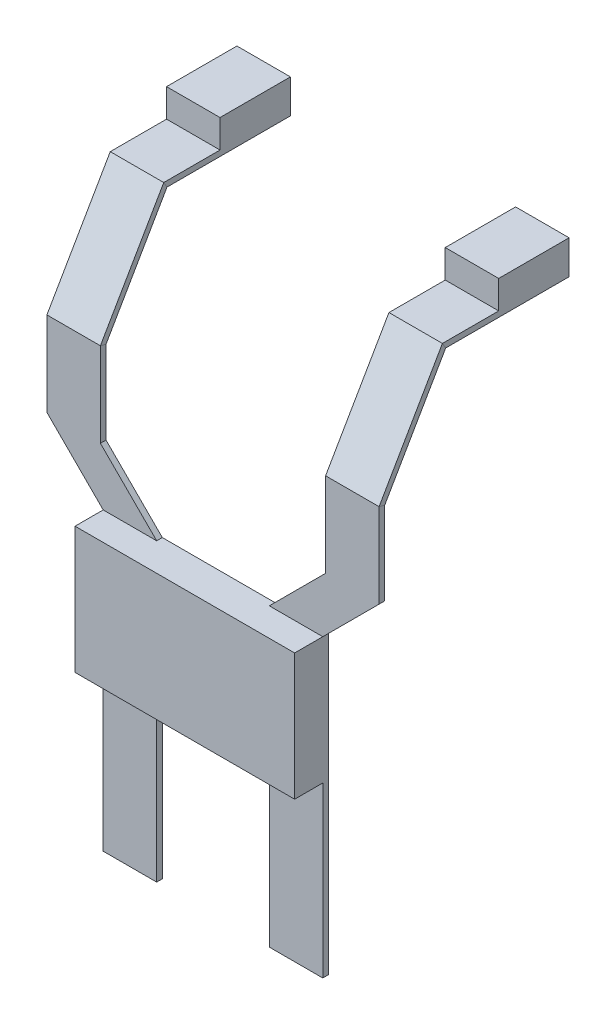
from build123d import *

# Parameters (mm, degrees)
EXTRUDE_1_DEPTH = 4
SKETCH_11_W     = 156
SKETCH_11_H     = 90
EXTRUDE_2_DEPTH = 20
SKETCH_12_W     = 38
SKETCH_12_H     = 4
SKETCH_14_W     = 38
SKETCH_14_H     = 50
EXTRUDE_3_DEPTH = 20


with BuildPart() as part:
    # 草图1 → 凸台-拉伸1 (new body)
    with BuildSketch(Plane.XY):
        Polygon((-40, 0), (40, 0), (40, -160), (78, -160), (78, 0), (78, 50), (118, 90), (80, 90), (40, 50), (-40, 50), (-80, 90), (-118, 90), (-78, 50), (-78, 0), (-78, -160), (-40, -160), align=None)
    extrude(amount=EXTRUDE_1_DEPTH)

    # 草图11 → 凸台-拉伸2 (add)
    with BuildSketch(Plane.XY.offset(4)):
        with Locations((0, 5)):
            Rectangle(SKETCH_11_W, SKETCH_11_H)
    extrude(amount=EXTRUDE_2_DEPTH)

    # 扫描1: sweep along a path in 草图13
    with BuildLine(Plane(origin=(78, 0, 0), x_dir=(0, 0, -1), z_dir=(1, 0, 0))) as sweep_1_path:
        Line((-4, 90), (-4, 150))
        Line((-4, 150), (41, 227.942286341))
        Line((41, 227.942286341), (131, 227.942286341))
    # 草图12 → 扫描1 (sweep)
    with BuildSketch(Plane(origin=(0, 90, 0), x_dir=(1, 0, 0), z_dir=(0, 1, 0))):
        with Locations((-99, -2)):
            Rectangle(SKETCH_12_W, SKETCH_12_H)
        with Locations((99, -2)):
            Rectangle(SKETCH_12_W, SKETCH_12_H)
    sweep(path=sweep_1_path.line, transition=Transition.RIGHT)

    # 草图14 → 凸台-拉伸3 (add)
    with BuildSketch(Plane(origin=(0, 227.942286341, 0), x_dir=(1, 0, 0), z_dir=(0, 1, 0))):
        with Locations((-99, 106)):
            Rectangle(SKETCH_14_W, SKETCH_14_H)
        with Locations((99, 106)):
            Rectangle(SKETCH_14_W, SKETCH_14_H)
    extrude(amount=EXTRUDE_3_DEPTH)


solid = part.part
